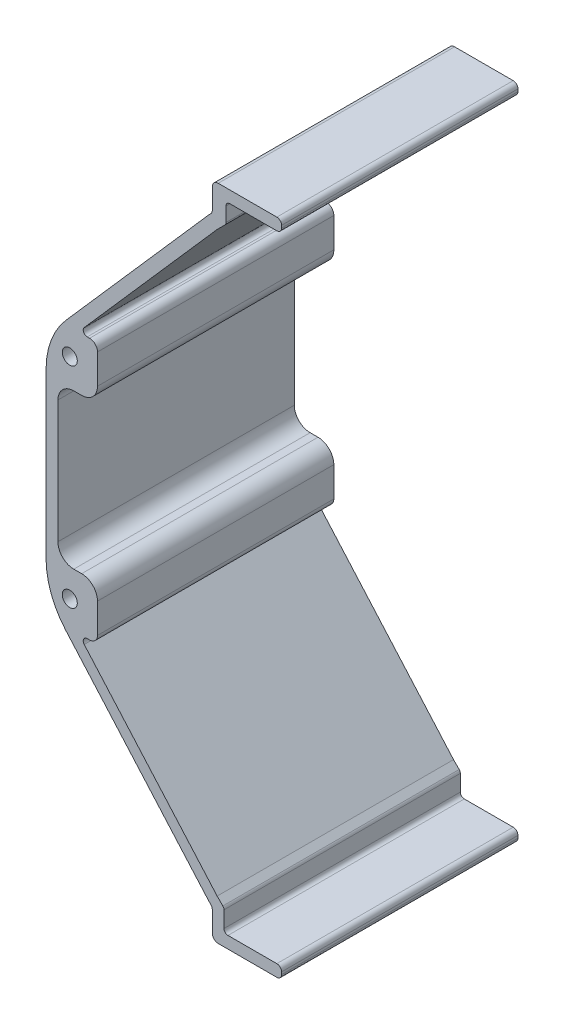
from build123d import *

# Parameters (mm, degrees)
EXTRUDE_START       = -29.85
EXTRUDE_1_DEPTH     = 59.7
CUT_EXTRUDE_START   = 30.35
SKETCH_2_R          = 1.9
CUT_EXTRUDE_1_DEPTH = 60.7


with BuildPart() as part:
    # 草图1 → 凸台-拉伸1 (new body)
    with BuildSketch(Plane.XY.offset(EXTRUDE_START)):
        with BuildLine():
            Line((-111.7, 80.15), (-123.55, 80.15))
            ThreePointArc((-123.55, 80.15), (-124.257106781, 79.857106781), (-124.55, 79.15))
            Line((-124.55, 79.15), (-124.55, 75.550213562))
            ThreePointArc((-124.55, 75.550213562), (-124.626120467, 75.16753013), (-124.842893219, 74.843106781))
            Line((-124.842893219, 74.843106781), (-126.773, 72.913))
            Line((-126.773, 72.913), (-160.353049521, 34.659710148))
            ThreePointArc((-160.353049521, 34.659710148), (-160.512493197, 33.587513726), (-159.601529381, 33))
            Line((-159.601529381, 33), (-159, 33))
            ThreePointArc((-159, 33), (-157.585786438, 32.414213562), (-157, 31))
            Line((-157, 31), (-157, 23.5))
            ThreePointArc((-157, 23.5), (-158.171572875, 20.671572875), (-161, 19.5))
            Line((-161, 19.5), (-162.989, 19.5))
            ThreePointArc((-162.989, 19.5), (-165.817427125, 18.328427125), (-166.989, 15.5))
            Line((-166.989, 15.5), (-166.989, -15.5))
            ThreePointArc((-166.989, -15.5), (-165.817427125, -18.328427125), (-162.989, -19.5))
            Line((-162.989, -19.5), (-161, -19.5))
            ThreePointArc((-161, -19.5), (-158.171572875, -20.671572875), (-157, -23.5))
            Line((-157, -23.5), (-157, -31))
            ThreePointArc((-157, -31), (-157.585786438, -32.414213562), (-159, -33))
            Line((-159, -33), (-159.601529381, -33))
            ThreePointArc((-159.601529381, -33), (-160.512493197, -33.587513726), (-160.353049521, -34.659710148))
            Line((-160.353049521, -34.659710148), (-126.773, -72.913))
            Line((-126.773, -72.913), (-125.342893219, -74.343106781))
            ThreePointArc((-125.342893219, -74.343106781), (-125.126120467, -74.66753013), (-125.05, -75.050213562))
            Line((-125.05, -75.050213562), (-125.05, -79.15))
            ThreePointArc((-125.05, -79.15), (-124.757106781, -79.857106781), (-124.05, -80.15))
            Line((-124.05, -80.15), (-111.7, -80.15))
            ThreePointArc((-111.7, -80.15), (-110.851471863, -80.501471863), (-110.5, -81.35))
            Line((-110.5, -81.35), (-110.5, -81.95))
            ThreePointArc((-110.5, -81.95), (-110.851471863, -82.798528137), (-111.7, -83.15))
            Line((-111.7, -83.15), (-126.5, -83.15))
            ThreePointArc((-126.5, -83.15), (-127.560660172, -82.710660172), (-128, -81.65))
            Line((-128, -81.65), (-128, -76.550320344))
            ThreePointArc((-128, -76.550320344), (-128.114180701, -75.976295195), (-128.439339828, -75.489660172))
            Line((-128.439339828, -75.489660172), (-128.963, -74.966))
            Line((-128.963, -74.966), (-165.023, -33.887))
            ThreePointArc((-165.023, -33.887), (-168.70682882, -27.745711718), (-169.989, -20.7))
            Line((-169.989, -20.7), (-169.989, 20.7))
            ThreePointArc((-169.989, 20.7), (-168.70682882, 27.745711718), (-165.023, 33.887))
            Line((-165.023, 33.887), (-128.963, 74.966))
            Line((-128.963, 74.966), (-128.439339828, 75.489660172))
            ThreePointArc((-128.439339828, 75.489660172), (-128.114180701, 75.976295195), (-128, 76.550320344))
            Line((-128, 76.550320344), (-128, 81.65))
            ThreePointArc((-128, 81.65), (-127.560660172, 82.710660172), (-126.5, 83.15))
            Line((-126.5, 83.15), (-111.7, 83.15))
            ThreePointArc((-111.7, 83.15), (-110.851471863, 82.798528137), (-110.5, 81.95))
            Line((-110.5, 81.95), (-110.5, 81.35))
            ThreePointArc((-110.5, 81.35), (-110.851471863, 80.501471863), (-111.7, 80.15))
        make_face()
    extrude(amount=EXTRUDE_1_DEPTH)

    # 草图2 → 切除-拉伸1 (cut)
    with BuildSketch(Plane.XY.offset(CUT_EXTRUDE_START)):
        with Locations(Location((-164, 26.5, 0), (0, 0, 180))):
            Circle(SKETCH_2_R)
        with Locations(Location((-164, -26.5, 0), (0, 0, 180))):
            Circle(SKETCH_2_R)
    extrude(amount=-CUT_EXTRUDE_1_DEPTH, mode=Mode.SUBTRACT)


solid = part.part
